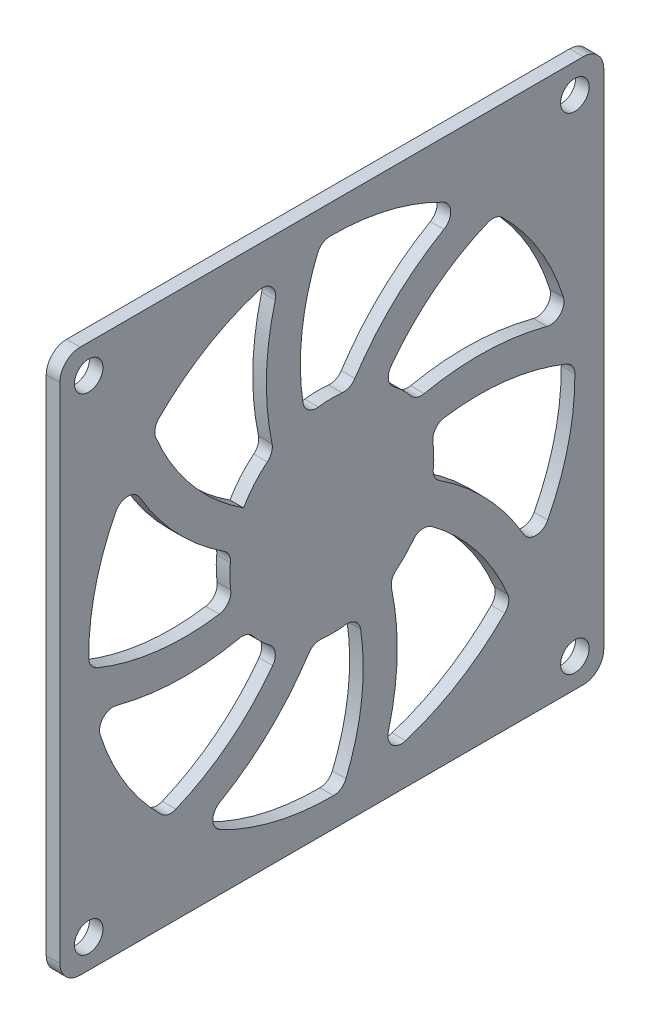
from build123d import *

# Parameters (mm, degrees)
SKETCH_1_W          = 80
SKETCH_1_H          = 80
SKETCH_1_R          = 2.1
EXTRUDE_1_DEPTH     = 2
FILLET_1_R          = 3
CUT_EXTRUDE_2_DEPTH = 57.603886792
FILLET_2_R          = 2


with BuildPart() as part:
    # ｽｹｯﾁ1 → ﾎﾞｽ - 押し出し1 (new body)
    with BuildSketch(Plane(origin=(0, 0, 0), x_dir=(0, 0, -1), z_dir=(1, 0, 0))):
        Rectangle(SKETCH_1_W, SKETCH_1_H)
        with Locations((35.75, 35.75)):
            Circle(SKETCH_1_R, mode=Mode.SUBTRACT)
        with Locations((35.75, -35.75)):
            Circle(SKETCH_1_R, mode=Mode.SUBTRACT)
        with Locations((-35.75, -35.75)):
            Circle(SKETCH_1_R, mode=Mode.SUBTRACT)
        with Locations((-35.75, 35.75)):
            Circle(SKETCH_1_R, mode=Mode.SUBTRACT)
    extrude(amount=EXTRUDE_1_DEPTH)

    # ﾌｨﾚｯﾄ1
    fillet_1_edges = [part.edges().sort_by_distance(p)[0] for p in [
        (1, -40, -40),
        (1, -40, 40),
        (1, 40, 40),
        (1, 40, -40),
    ]]
    fillet(fillet_1_edges, radius=FILLET_1_R)

    # ｽｹｯﾁ5 → ｶｯﾄ - 押し出し2 (cut, through all)
    with BuildSketch(Plane(origin=(2, 0, 0), x_dir=(0, 0, -1), z_dir=(1, 0, 0))):
        with BuildLine():
            ThreePointArc((-7.256908486, 35.005710666), (-17.663861434, 31.081352918), (-26.361107342, 24.1485925))
            ThreePointArc((-26.361107342, 24.1485925), (-21.014844614, 14.751134728), (-12.981913841, 7.514646567))
            ThreePointArc((-12.981913841, 7.514646567), (-11.012351321, 10.18470021), (-8.503997866, 12.356456624))
            ThreePointArc((-8.503997866, 12.356456624), (-9.567886218, 23.773995306), (-7.256908486, 35.005710666))
        make_face()
        with BuildLine():
            ThreePointArc((-14.750568828, 2.724099712), (-23.576270523, 10.045236071), (-29.884184593, 19.621366191))
            ThreePointArc((-29.884184593, 19.621366191), (-34.468071619, 9.487599215), (-35.715751274, -1.564484248))
            ThreePointArc((-35.715751274, -1.564484248), (-25.290366529, -4.429111736), (-14.493256855, -3.865941764))
            ThreePointArc((-14.493256855, -3.865941764), (-14.988578879, -0.585237713), (-14.750568828, 2.724099712))
        make_face()
        with BuildLine():
            ThreePointArc((19.621366191, 29.884184593), (9.487599215, 34.468071619), (-1.564484248, 35.715751274))
            ThreePointArc((-1.564484248, 35.715751274), (-4.429111736, 25.290366529), (-3.865941764, 14.493256855))
            ThreePointArc((-3.865941764, 14.493256855), (-0.585237713, 14.988578879), (2.724099712, 14.750568828))
            ThreePointArc((2.724099712, 14.750568828), (10.045236071, 23.576270523), (19.621366191, 29.884184593))
        make_face()
        with BuildLine():
            ThreePointArc((-12.356456624, -8.503997866), (-23.773995306, -9.567886218), (-35.005710666, -7.256908486))
            ThreePointArc((-35.005710666, -7.256908486), (-31.081352918, -17.663861434), (-24.1485925, -26.361107342))
            ThreePointArc((-24.1485925, -26.361107342), (-14.751134728, -21.014844614), (-7.514646567, -12.981913841))
            ThreePointArc((-7.514646567, -12.981913841), (-10.18470021, -11.012351321), (-12.356456624, -8.503997866))
        make_face()
        with BuildLine():
            ThreePointArc((35.005710666, 7.256908486), (31.081352918, 17.663861434), (24.1485925, 26.361107342))
            ThreePointArc((24.1485925, 26.361107342), (14.751134728, 21.014844614), (7.514646567, 12.981913841))
            ThreePointArc((7.514646567, 12.981913841), (10.18470021, 11.012351321), (12.356456624, 8.503997866))
            ThreePointArc((12.356456624, 8.503997866), (23.773995306, 9.567886218), (35.005710666, 7.256908486))
        make_face()
        with BuildLine():
            ThreePointArc((-2.724099712, -14.750568828), (-10.045236071, -23.576270523), (-19.621366191, -29.884184593))
            ThreePointArc((-19.621366191, -29.884184593), (-9.487599215, -34.468071619), (1.564484248, -35.715751274))
            ThreePointArc((1.564484248, -35.715751274), (4.429111736, -25.290366529), (3.865941764, -14.493256855))
            ThreePointArc((3.865941764, -14.493256855), (0.585237713, -14.988578879), (-2.724099712, -14.750568828))
        make_face()
        with BuildLine():
            ThreePointArc((29.884184593, -19.621366191), (34.468071619, -9.487599215), (35.715751274, 1.564484248))
            ThreePointArc((35.715751274, 1.564484248), (25.290366529, 4.429111736), (14.493256855, 3.865941764))
            ThreePointArc((14.493256855, 3.865941764), (14.988578879, 0.585237713), (14.750568828, -2.724099712))
            ThreePointArc((14.750568828, -2.724099712), (23.576270523, -10.045236071), (29.884184593, -19.621366191))
        make_face()
        with BuildLine():
            ThreePointArc((8.503997866, -12.356456624), (9.567886218, -23.773995306), (7.256908486, -35.005710666))
            ThreePointArc((7.256908486, -35.005710666), (17.663861434, -31.081352918), (26.361107342, -24.1485925))
            ThreePointArc((26.361107342, -24.1485925), (21.014844614, -14.751134728), (12.981913841, -7.514646567))
            ThreePointArc((12.981913841, -7.514646567), (11.012351321, -10.18470021), (8.503997866, -12.356456624))
        make_face()
    extrude(amount=-CUT_EXTRUDE_2_DEPTH, mode=Mode.SUBTRACT)

    # ﾌｨﾚｯﾄ2
    fillet_2_edges = [part.edges().sort_by_distance(p)[0] for p in [
        (1, 3.865941764, -14.493256855),
        (1, 1.564484248, -35.715751274),
        (1, -19.621366191, -29.884184593),
        (1, -2.724099712, -14.750568828),
        (1, 8.503997866, -12.356456624),
        (1, 12.981913841, -7.514646567),
        (1, 26.361107342, -24.1485925),
        (1, 7.256908486, -35.005710666),
        (1, 12.356456624, 8.503997866),
        (1, 24.1485925, 26.361107342),
        (1, 35.005710666, 7.256908486),
        (1, 2.724099712, 14.750568828),
        (1, -3.865941764, 14.493256855),
        (1, -1.564484248, 35.715751274),
        (1, 19.621366191, 29.884184593),
        (1, -8.503997866, 12.356456624),
        (1, -12.981913841, 7.514646567),
        (1, -26.361107342, 24.1485925),
        (1, -7.256908486, 35.005710666),
        (1, 14.750568828, -2.724099712),
        (1, 14.493256855, 3.865941764),
        (1, 35.715751274, 1.564484248),
        (1, 29.884184593, -19.621366191),
        (1, -14.750568828, 2.724099712),
        (1, -14.493256855, -3.865941764),
        (1, -35.715751274, -1.564484248),
        (1, -29.884184593, 19.621366191),
        (1, -12.356456624, -8.503997866),
        (1, -7.514646567, -12.981913841),
        (1, -24.1485925, -26.361107342),
        (1, -35.005710666, -7.256908486),
    ]]
    fillet(fillet_2_edges, radius=FILLET_2_R)


solid = part.part
